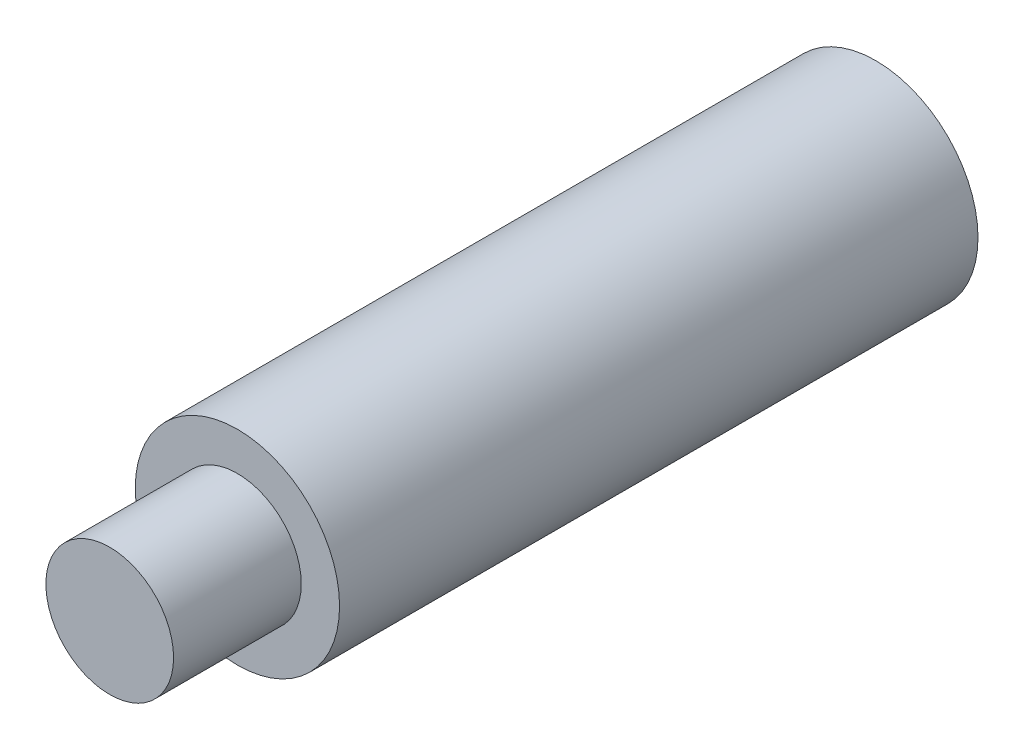
from build123d import *

# Parameters (mm, degrees)
SKETCH1_R           = 4
BOSS_EXTRUDE1_DEPTH = 25
SKETCH2_R           = 2.5
BOSS_EXTRUDE2_DEPTH = 5


with BuildPart() as part:
    # Sketch1 → Boss-Extrude1 (new body)
    with BuildSketch(Plane.XY):
        Circle(SKETCH1_R)
    extrude(amount=BOSS_EXTRUDE1_DEPTH)

    # Sketch2 → Boss-Extrude2 (add)
    with BuildSketch(Plane.XY.offset(25)):
        Circle(SKETCH2_R)
    extrude(amount=BOSS_EXTRUDE2_DEPTH)


solid = part.part
